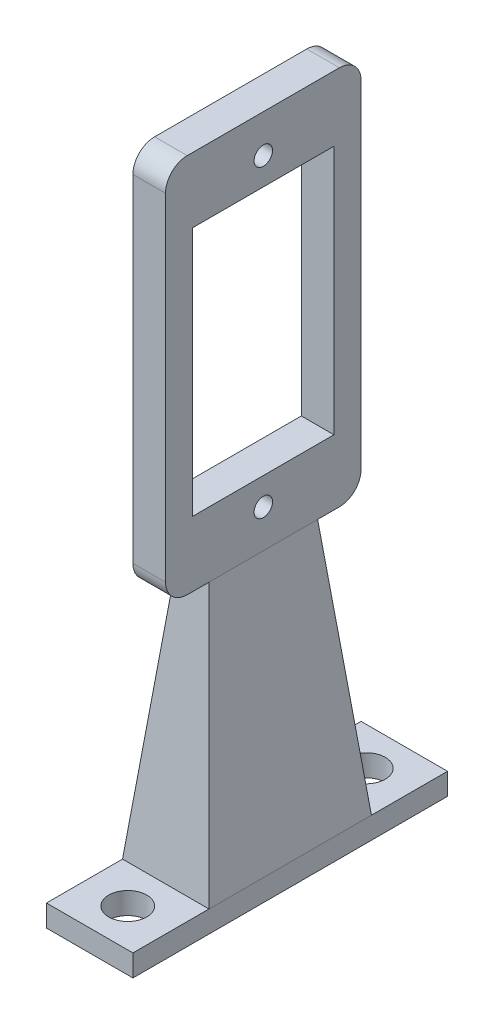
from build123d import *

# Parameters (mm, degrees)
ESBO_O1_W                = 18
ESBO_O1_H                = 35
RESSALTO_EXTRUS_O1_DEPTH = 1.5
CORTE_EXTRUS_O1_REACH    = 21.906
ESBO_O2_W                = 13
ESBO_O2_H                = 23
CORTE_EXTRUS_O2_REACH    = 21.906
ESBO_O3_R                = 0.85
FILETE1_R                = 2
ESBO_O4_W                = 3
ESBO_O4_H                = 10
RESSALTO_EXTRUS_O2_DEPTH = 23.57
RESSALTO_EXTRUS_O2_TAPER = -6
ESBO_O5_W                = 7.95461365
ESBO_O5_H                = 28.95461365
RESSALTO_EXTRUS_O3_DEPTH = 2
CORTE_EXTRUS_O3_REACH    = 62.464
ESBO_O6_R                = 1.75


with BuildPart() as part:
    # Esboço1 → Ressalto-extrusão1 (new, symmetric)
    with BuildSketch(Plane(origin=(0, 0, 0), x_dir=(0, 0, -1), z_dir=(1, 0, 0))):
        Rectangle(ESBO_O1_W, ESBO_O1_H)
    extrude(amount=RESSALTO_EXTRUS_O1_DEPTH, both=True)

    # Esboço2 → Corte-extrusão1 (cut, up to next)
    with BuildSketch(Plane(origin=(1.5, 0, 0), x_dir=(0, 0, -1), z_dir=(1, 0, 0)), mode=Mode.PRIVATE) as corte_extrus_o1_sk1:
        Rectangle(ESBO_O2_W, ESBO_O2_H)
    corte_extrus_o1_tool1 = extrude(corte_extrus_o1_sk1.sketch, amount=-CORTE_EXTRUS_O1_REACH, mode=Mode.PRIVATE) & part.part
    add(corte_extrus_o1_tool1.solids().sort_by_distance((1.5, 0, 0))[0], mode=Mode.SUBTRACT)

    # Esboço3 → Corte-extrusão2 (cut, up to next)
    with BuildSketch(Plane.ZY.offset(1.5), mode=Mode.PRIVATE) as corte_extrus_o2_sk1:
        with Locations((0, 14)):
            Circle(ESBO_O3_R)
    corte_extrus_o2_tool1 = extrude(corte_extrus_o2_sk1.sketch, amount=-CORTE_EXTRUS_O2_REACH, mode=Mode.PRIVATE) & part.part
    # Esboço3 → Corte-extrusão2 (cut, up to next)
    with BuildSketch(Plane.ZY.offset(1.5), mode=Mode.PRIVATE) as corte_extrus_o2_sk2:
        with Locations((0, -14)):
            Circle(ESBO_O3_R)
    corte_extrus_o2_tool2 = extrude(corte_extrus_o2_sk2.sketch, amount=-CORTE_EXTRUS_O2_REACH, mode=Mode.PRIVATE) & part.part
    add(corte_extrus_o2_tool1.solids().sort_by_distance((-1.5, 14, 0))[0], mode=Mode.SUBTRACT)
    add(corte_extrus_o2_tool2.solids().sort_by_distance((-1.5, -14, 0))[0], mode=Mode.SUBTRACT)

    # Filete1
    filete1_edges = [part.edges().sort_by_distance(p)[0] for p in [
        (0, -17.5, -9),
        (0, -17.5, 9),
        (0, 17.5, 9),
        (0, 17.5, -9),
    ]]
    fillet(filete1_edges, radius=FILETE1_R)

    # Esboço4 → Ressalto-extrusão2 (add)
    with BuildSketch(Plane.XZ.offset(17.5)):
        Rectangle(ESBO_O4_W, ESBO_O4_H)
    extrude(amount=RESSALTO_EXTRUS_O2_DEPTH, taper=RESSALTO_EXTRUS_O2_TAPER)

    # Esboço5 → Ressalto-extrusão3 (add)
    with BuildSketch(Plane.XZ.offset(41.07)):
        Rectangle(ESBO_O5_W, ESBO_O5_H)
    extrude(amount=RESSALTO_EXTRUS_O3_DEPTH)

    # Esboço6 → Corte-extrusão3 (cut, up to next)
    with BuildSketch(Plane(origin=(0, -41.07, 0), x_dir=(1, 0, 0), z_dir=(0, 1, 0)), mode=Mode.PRIVATE) as corte_extrus_o3_sk1:
        with Locations(Location((0, 10.977306825, 0), (0, 0, 270))):
            Circle(ESBO_O6_R)
    corte_extrus_o3_tool1 = extrude(corte_extrus_o3_sk1.sketch, amount=-CORTE_EXTRUS_O3_REACH, mode=Mode.PRIVATE) & part.part
    # Esboço6 → Corte-extrusão3 (cut, up to next)
    with BuildSketch(Plane(origin=(0, -41.07, 0), x_dir=(1, 0, 0), z_dir=(0, 1, 0)), mode=Mode.PRIVATE) as corte_extrus_o3_sk2:
        with Locations(Location((0, -10.977306825, 0), (0, 0, 270))):
            Circle(ESBO_O6_R)
    corte_extrus_o3_tool2 = extrude(corte_extrus_o3_sk2.sketch, amount=-CORTE_EXTRUS_O3_REACH, mode=Mode.PRIVATE) & part.part
    add(corte_extrus_o3_tool1.solids().sort_by_distance((0, -41.07, -10.977307))[0], mode=Mode.SUBTRACT)
    add(corte_extrus_o3_tool2.solids().sort_by_distance((0, -41.07, 10.977307))[0], mode=Mode.SUBTRACT)


solid = part.part
